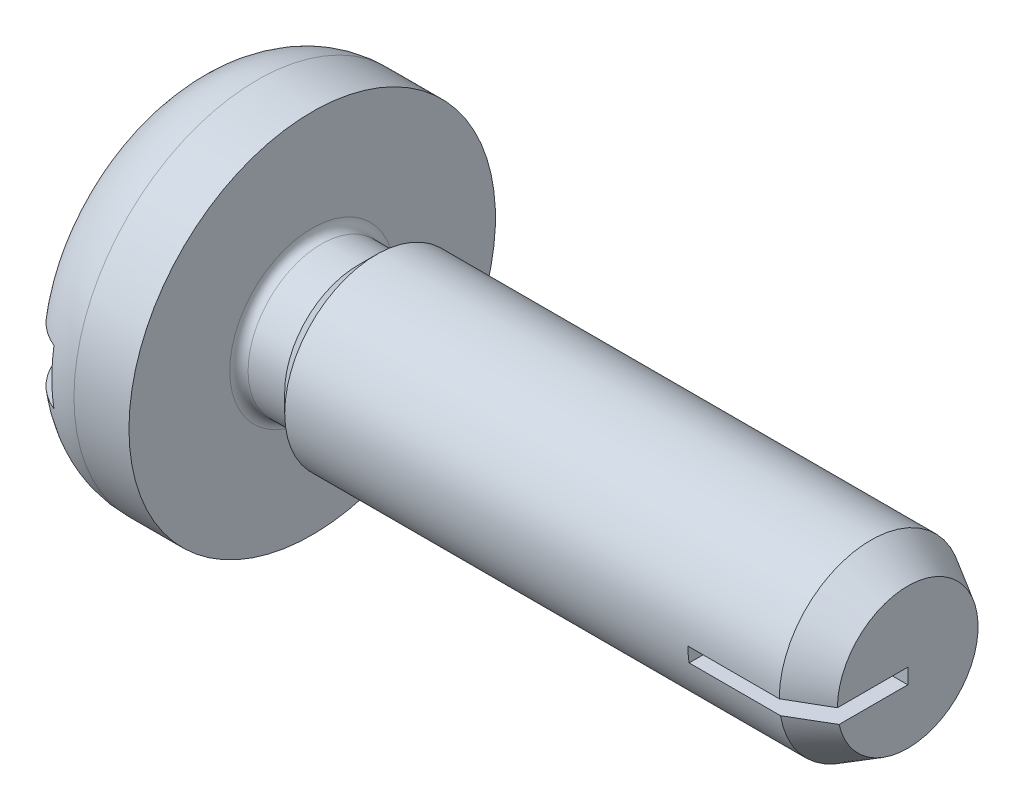
from build123d import *

# Parameters (mm, degrees)
SLOT_CUT_EXTRUDE1_DEPTH      = 17.78213338
SLOT_CUT_EXTRUDE1_DEPTH_BACK = 17.78213338
SKETCH2_W                    = 1
SKETCH2_H                    = 1.2
SKETCH11_W                   = 2.8
SKETCH11_H                   = 0.333333333
POINT_CUT_EXTRUDE8_DEPTH     = 17.782133404


with BuildPart() as part:
    # Sketch1 → base-Revolve (revolve)
    with BuildSketch(Plane.XY, mode=Mode.PRIVATE) as base_revolve_sk:
        with BuildLine():
            Line((0, 0), (0, 2.4))
            ThreePointArc((0, 2.4), (0.46862915, 3.53137085), (1.6, 4))
            Line((1.6, 4), (2.8, 4))
            Line((2.8, 4), (2.8, 1.8))
            ThreePointArc((2.8, 1.8), (2.858578644, 1.658578644), (3, 1.6))
            Line((3, 1.6), (3.8, 1.6))
            Line((3.8, 1.6), (4.2, 2))
            Line((4.2, 2), (15.8, 2))
            Line((15.8, 2), (15.8, 0))
            Line((15.8, 0), (0, 0))
        make_face()
    revolve(base_revolve_sk.sketch.rotate(Axis((0, 0, 0), (1, 0, 0)), 90), axis=Axis((0, 0, 0), (1, 0, 0)))

    # Sketch2 → slot_Cut-Extrude1 (cut, two sides: drawn at the far end of the back side and taken through both)
    with BuildSketch(Plane.XY.offset(-SLOT_CUT_EXTRUDE1_DEPTH_BACK)):
        with Locations((0.5, 0)):
            Rectangle(SKETCH2_W, SKETCH2_H)
    extrude(amount=SLOT_CUT_EXTRUDE1_DEPTH + SLOT_CUT_EXTRUDE1_DEPTH_BACK, mode=Mode.SUBTRACT)

    # Sketch8 → point_Cut-Revolve1 (revolve, cut)
    with BuildSketch(Plane.XY, mode=Mode.PRIVATE) as point_cut_revolve1_sk:
        Polygon((15.8, 0), (16.308, 0), (16.308, 2.508), (14.994596374, 2.508), (14.994596374, 2), (15.8, 1.535), align=None)
    revolve(point_cut_revolve1_sk.sketch.rotate(Axis((0, 0, 0), (1, 0, 0)), 90), axis=Axis((0, 0, 0), (1, 0, 0)), mode=Mode.SUBTRACT)

    # Sketch11 → point_Cut-Extrude8 (cut, through all)
    with BuildSketch(Plane.XY):
        with Locations((14.4, -0.166666667)):
            Rectangle(SKETCH11_W, SKETCH11_H)
    extrude(amount=POINT_CUT_EXTRUDE8_DEPTH, mode=Mode.SUBTRACT)


solid = part.part
